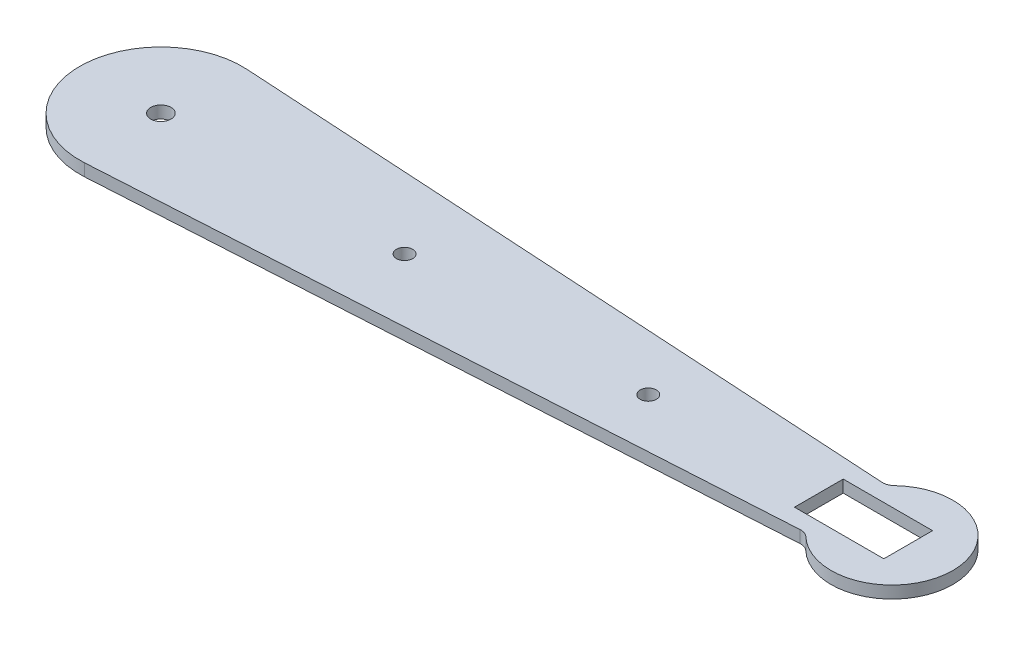
from build123d import *

# Parameters (mm, degrees)
SKETCH1_R           = 2
SKETCH1_R_2         = 2.5
BOSS_EXTRUDE1_DEPTH = 3
FILLET2_R           = 3
FILLET3_R           = 3
SKETCH2_W           = 22
SKETCH2_H           = 12
CUT_EXTRUDE1_DEPTH  = 10


with BuildPart() as part:
    # Sketch1 → Boss-Extrude1 (new body)
    with BuildSketch(Plane(origin=(0, 0, 0), x_dir=(1, 0, 0), z_dir=(0, 1, 0))):
        with BuildLine():
            ThreePointArc((1.186783721, 19.964757559), (-20, 0), (1.186783721, -19.964757559))
            Line((1.186783721, -19.964757559), (168.819660113, -10))
            ThreePointArc((168.819660113, -10), (195, 0), (168.819660113, 10))
            Line((168.819660113, 10), (1.186783721, 19.964757559))
        make_face()
        with Locations(Location((60, 0, 0), (0, 0, 270))):
            Circle(SKETCH1_R, mode=Mode.SUBTRACT)
        with Locations(Location((0, 0, 0), (0, 0, 270))):
            Circle(SKETCH1_R_2, mode=Mode.SUBTRACT)
        with Locations(Location((120, 0, 0), (0, 0, 270))):
            Circle(SKETCH1_R, mode=Mode.SUBTRACT)
    extrude(amount=BOSS_EXTRUDE1_DEPTH)

    # Fillet2
    fillet2_edges = [part.edges().sort_by_distance(p)[0] for p in [
        (168.819660113, 1.5, -10),
    ]]
    fillet(fillet2_edges, radius=FILLET2_R)

    # Fillet3
    fillet3_edges = [part.edges().sort_by_distance(p)[0] for p in [
        (168.819660113, 1.5, 10),
    ]]
    fillet(fillet3_edges, radius=FILLET3_R)

    # Sketch2 → Cut-Extrude1 (cut)
    with BuildSketch(Plane(origin=(0, 3, 0), x_dir=(1, 0, 0), z_dir=(0, 1, 0))):
        with Locations((173, 0)):
            Rectangle(SKETCH2_W, SKETCH2_H)
    extrude(amount=-CUT_EXTRUDE1_DEPTH, mode=Mode.SUBTRACT)


solid = part.part
